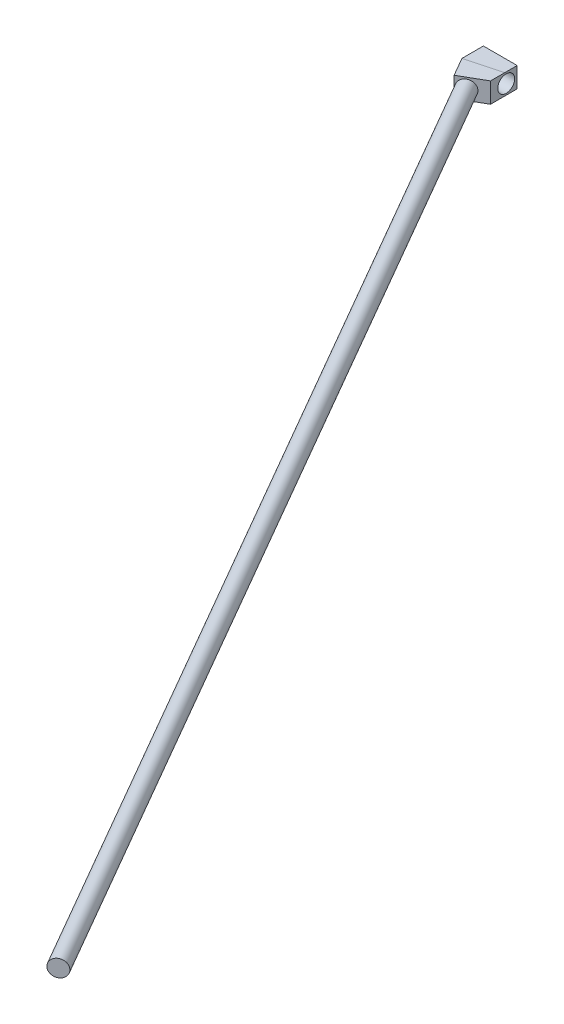
from build123d import *

# Parameters (mm, degrees)
SKETCH1_W           = 10
SKETCH1_H           = 6
SKETCH5_R           = 2.5
CUT_EXTRUDE1_DEPTH  = 17.997170664
SKETCH6_R           = 2.5
BOSS_EXTRUDE1_DEPTH = 330


with BuildPart() as part:
    # Sweep2: sweep along a path in Sketch4
    with BuildLine(Plane(origin=(0, 0, 0), x_dir=(1, 0, 0), z_dir=(0, 1, 0))) as sweep2_path:
        Line((0, 0), (0, -5))
        Line((0, -5), (2.5, -9.330127019))
    # Sketch1 → Sweep2 (sweep)
    with BuildSketch(Plane.XY):
        Rectangle(SKETCH1_W, SKETCH1_H)
    sweep(path=sweep2_path.line, transition=Transition.RIGHT)

    # Sketch5 → Cut-Extrude1 (cut, through all)
    with BuildSketch(Plane.ZY.offset(5)):
        with Locations(Location((3.245776798, 0, 0), (0, 0, 270))):
            Circle(SKETCH5_R)
    extrude(amount=-CUT_EXTRUDE1_DEPTH, mode=Mode.SUBTRACT)

    # SurfaceCut1
    split(bisect_by=Plane(origin=(5, 0, 0), x_dir=(0, 0, -1), z_dir=(1, 0, 0)), keep=Keep.BOTTOM)

    # Sketch6 → Boss-Extrude1 (add)
    with BuildSketch(Plane(origin=(4.665063509, 0, 8.080127019), x_dir=(0.8660254037844379, 0, -0.5000000000000013), z_dir=(0.5000000000000012, 0, 0.8660254037844378))):
        with Locations((-4.837322129, 0)):
            Circle(SKETCH6_R)
    extrude(amount=BOSS_EXTRUDE1_DEPTH)


solid = part.part
